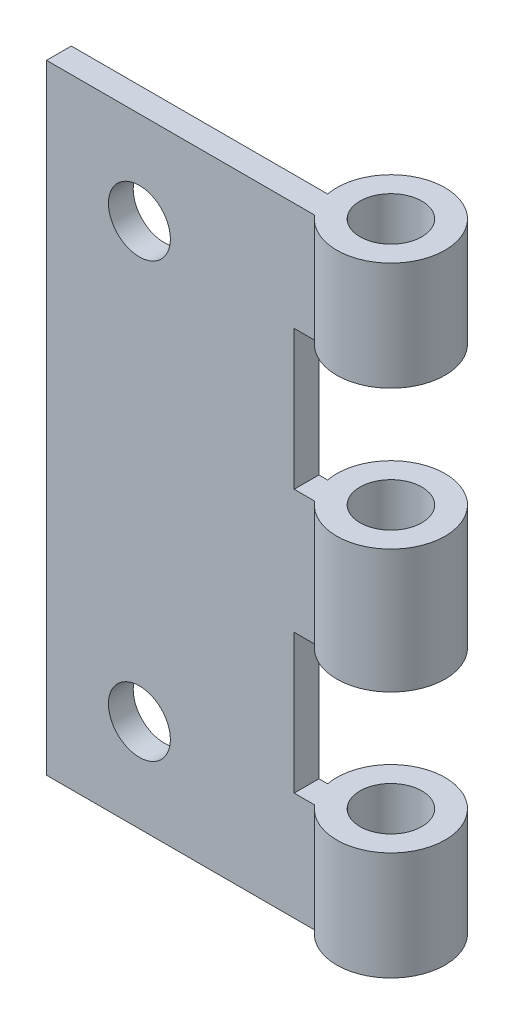
from build123d import *

# Parameters (mm, degrees)
BOSS_EXTRUDE1_DEPTH = 50.8
SKETCH2_R           = 2.54
CUT_EXTRUDE1_DEPTH  = 50.8
CUT_EXTRUDE2_START  = 8.89
CUT_EXTRUDE2_DEPTH  = 11.43
CUT_EXTRUDE3_START  = 30.48
CUT_EXTRUDE3_DEPTH  = 11.43
SKETCH3_R           = 2.54
CUT_EXTRUDE4_DEPTH  = 60.369104181


with BuildPart() as part:
    # Sketch1 → Boss-Extrude1 (new body)
    with BuildSketch(Plane(origin=(0, 0, 0), x_dir=(1, 0, 0), z_dir=(0, 1, 0))):
        with BuildLine():
            Line((0, 0), (21.995191819, 0))
            ThreePointArc((21.995191819, 0), (29.416855136, 4.760891662), (21.032326163, 2.032))
            Line((21.032326163, 2.032), (0, 2.032))
            Line((0, 2.032), (0, 0))
        make_face()
    extrude(amount=BOSS_EXTRUDE1_DEPTH)

    # Sketch2 → Cut-Extrude1 (cut)
    with BuildSketch(Plane(origin=(0, 0, -2.032), x_dir=(-1, 0, 0), z_dir=(0, 0, -1))):
        with Locations((-7.62, 43.18)):
            Circle(SKETCH2_R)
        with Locations((-7.62, 7.62)):
            Circle(SKETCH2_R)
    extrude(amount=-CUT_EXTRUDE1_DEPTH, mode=Mode.SUBTRACT)

    # Sketch1<3> → Cut-Extrude2 (cut)
    with BuildSketch(Plane(origin=(0, 0, 0), x_dir=(1, 0, 0), z_dir=(0, 1, 0)).offset(CUT_EXTRUDE2_START)):
        with BuildLine():
            Line((21.032326163, 2.032), (20.32, 2.032))
            Line((20.32, 2.032), (20.32, 0))
            Line((20.32, 0), (21.995191819, 0))
            ThreePointArc((21.995191819, 0), (29.416855136, 4.760891662), (21.032326163, 2.032))
        make_face()
    extrude(amount=CUT_EXTRUDE2_DEPTH, mode=Mode.SUBTRACT)

    # Sketch1<5> → Cut-Extrude3 (cut)
    with BuildSketch(Plane(origin=(0, 0, 0), x_dir=(1, 0, 0), z_dir=(0, 1, 0)).offset(CUT_EXTRUDE3_START)):
        with BuildLine():
            Line((21.032326163, 2.032), (20.32, 2.032))
            Line((20.32, 2.032), (20.32, 0))
            Line((20.32, 0), (21.995191819, 0))
            ThreePointArc((21.995191819, 0), (29.416855136, 4.760891662), (21.032326163, 2.032))
        make_face()
    extrude(amount=CUT_EXTRUDE3_DEPTH, mode=Mode.SUBTRACT)

    # Sketch3 → Cut-Extrude4 (cut, through all)
    with BuildSketch(Plane(origin=(0, 50.8, 0), x_dir=(1, 0, 0), z_dir=(0, 1, 0))):
        with Locations((25.4, 2.8575)):
            Circle(SKETCH3_R)
    extrude(amount=-CUT_EXTRUDE4_DEPTH, mode=Mode.SUBTRACT)


solid = part.part
